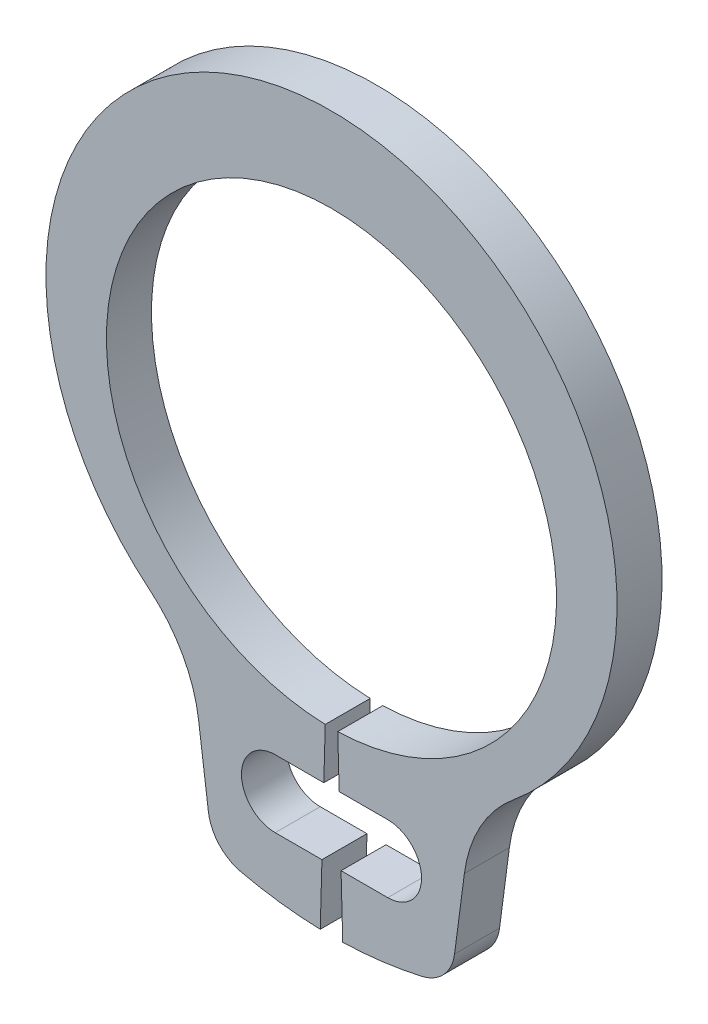
from build123d import *

# Parameters (mm, degrees)
BODYSKE_R   = 0.6
BODY_DEPTH  = 0.8
NOTSKE_W    = 2
NOTSKE_H    = 1.2
NOTCH_DEPTH = 9.842912471


with BuildPart() as part:
    # BodySke → Body (new body)
    with BuildSketch(Plane.XY):
        with BuildLine():
            Line((0.111111111, -3.998456492), (0.2, -7.197221686))
            ThreePointArc((0.2, -7.197221686), (0.91025881, -7.142228567), (1.61160657, -7.01731603))
            ThreePointArc((1.61160657, -7.01731603), (1.998605432, -6.790938751), (2.187314531, -6.384240254))
            Line((2.187314531, -6.384240254), (2.361999816, -5.057373784))
            ThreePointArc((2.361999816, -5.057373784), (2.647559395, -4.190941886), (3.230582946, -3.489278116))
            ThreePointArc((3.230582946, -3.489278116), (0, 5.5), (-3.230582946, -3.489278116))
            ThreePointArc((-3.230582946, -3.489278116), (-2.647559395, -4.190941886), (-2.361999816, -5.057373784))
            Line((-2.361999816, -5.057373784), (-2.187314531, -6.384240254))
            ThreePointArc((-2.187314531, -6.384240254), (-1.998605432, -6.790938751), (-1.61160657, -7.01731603))
            ThreePointArc((-1.61160657, -7.01731603), (-0.91025881, -7.142228567), (-0.2, -7.197221686))
            Line((-0.2, -7.197221686), (-0.111111111, -3.998456492))
            ThreePointArc((-0.111111111, -3.998456492), (0, 4), (0.111111111, -3.998456492))
        make_face()
        with Locations((1, -5.509990926)):
            Circle(BODYSKE_R, mode=Mode.SUBTRACT)
        with Locations((-1, -5.509990926)):
            Circle(BODYSKE_R, mode=Mode.SUBTRACT)
    extrude(amount=-BODY_DEPTH)

    # NotSke → Notch (cut, through all)
    with BuildSketch(Plane.XY):
        with Locations((0, -5.509990926)):
            Rectangle(NOTSKE_W, NOTSKE_H)
    extrude(amount=-NOTCH_DEPTH, mode=Mode.SUBTRACT)


solid = part.part
